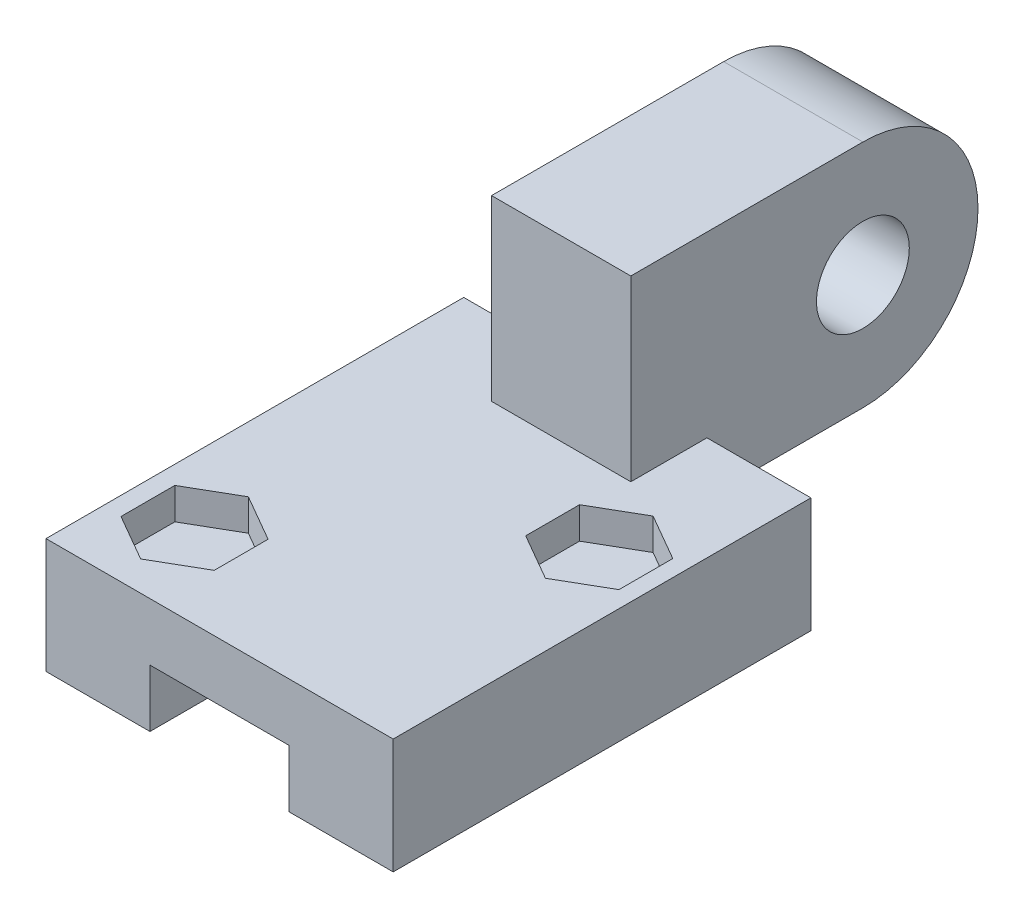
from build123d import *

# Parameters (mm, degrees)
SALIENTE_EXTRUIR2_DEPTH = 2.25
CORTAR_EXTRUIR1_DEPTH   = 0.17
CROQUIS3_R              = 0.25
SALIENTE_EXTRUIR4_DEPTH = 0.375


with BuildPart() as part:
    # Croquis1 → Saliente-Extruir2 (new body)
    with BuildSketch(Plane.XY):
        Polygon((0.375, -0.31), (0.935, -0.31), (0.935, 0.31), (-0.935, 0.31), (-0.935, -0.31), (-0.375, -0.31), (-0.375, 0), (0.375, 0), align=None)
    extrude(amount=-SALIENTE_EXTRUIR2_DEPTH)

    # Croquis2 → Cortar-Extruir1 (cut)
    with BuildSketch(Plane(origin=(0, 0.31, 0), x_dir=(1, 0, 0), z_dir=(0, 1, 0))):
        Polygon((0.595, 1.16), (0.846147367, 1.305), (0.846147367, 1.595), (0.595, 1.74), (0.343852633, 1.595), (0.343852633, 1.305), align=None)
        Polygon((-0.585, 0.16), (-0.333852633, 0.305), (-0.333852633, 0.595), (-0.585, 0.74), (-0.836147367, 0.595), (-0.836147367, 0.305), align=None)
    extrude(amount=-CORTAR_EXTRUIR1_DEPTH, mode=Mode.SUBTRACT)

    # Croquis3 → Saliente-Extruir4 (add, symmetric)
    with BuildSketch(Plane(origin=(0, 0, 0), x_dir=(0, 0, -1), z_dir=(1, 0, 0))):
        with BuildLine():
            Line((1.84, 0.03), (3.09, 0.03))
            ThreePointArc((3.09, 0.03), (3.71, 0.65), (3.09, 1.27))
            Line((3.09, 1.27), (1.84, 1.27))
            Line((1.84, 1.27), (1.84, 0.03))
        make_face()
        with Locations((3.09, 0.65)):
            Circle(CROQUIS3_R, mode=Mode.SUBTRACT)
    extrude(amount=SALIENTE_EXTRUIR4_DEPTH, both=True)


solid = part.part
